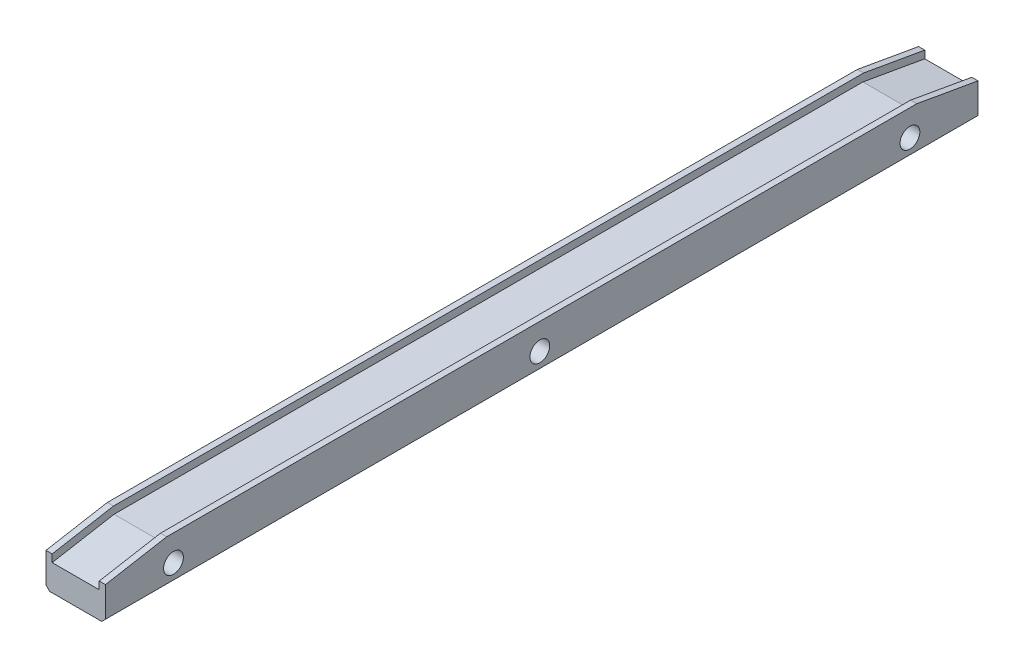
from build123d import *

# Parameters (mm, degrees)
RESSALTO_EXTRUS_O1_DEPTH = 327.5
ESBO_O2_R                = 8
CORTE_EXTRUS_O1_DEPTH    = 655
RESSALTO_EXTRUS_O2_DEPTH = 25
RESSALTO_EXTRUS_O3_DEPTH = 25
CHANFRO1_SIZE            = 50
CHANFRO1_SIZE2           = 8.816349035
CORTE_EXTRUS_O2_START    = -48
CORTE_EXTRUS_O2_DEPTH    = 48
CHANFRO2_SIZE            = 3


with BuildPart() as part:
    # Esboço1 → Ressalto-extrusão1 (new, symmetric)
    with BuildSketch(Plane.XY):
        Polygon((-19, 0), (19, 0), (19, 6), (24, 6), (24, -30), (-24, -30), (-24, 6), (-19, 6), align=None)
    extrude(amount=RESSALTO_EXTRUS_O1_DEPTH, both=True)

    # Esboço2 → Corte-extrusão1 (cut)
    with BuildSketch(Plane(origin=(24, 0, 0), x_dir=(0, 0, -1), z_dir=(1, 0, 0))):
        with Locations(Location((-297.5, -15, 0), (0, 0, 90))):
            Circle(ESBO_O2_R)
        with Locations(Location((297.5, -15, 0), (0, 0, 90))):
            Circle(ESBO_O2_R)
        with Locations(Location((-1.5, -15, 0), (0, 0, 90))):
            Circle(ESBO_O2_R)
    extrude(amount=-CORTE_EXTRUS_O1_DEPTH, mode=Mode.SUBTRACT)

    # Esboço3 → Ressalto-extrusão2 (add)
    with BuildSketch(Plane.XY.offset(327.5)):
        Polygon((-24, 6), (-24, -30), (24, -30), (24, 6), (19, 6), (19, 0), (-19, 0), (-19, 6), align=None)
    extrude(amount=RESSALTO_EXTRUS_O2_DEPTH)

    # Esboço4 → Ressalto-extrusão3 (add)
    with BuildSketch(Plane(origin=(0, 0, -327.5), x_dir=(-1, 0, 0), z_dir=(0, 0, -1))):
        Polygon((24, -30), (24, 6), (19, 6), (19, 0), (-19, 0), (-19, 6), (-24, 6), (-24, -30), align=None)
    extrude(amount=RESSALTO_EXTRUS_O3_DEPTH)

    # Chanfro1
    chanfro1_edges = [part.edges().sort_by_distance(p)[0] for p in [
        (0, 0, 352.5),
        (0, 0, -352.5),
    ]]
    chanfro1_side = [part.faces().sort_by_distance(p)[0] for p in [
        (0, 0, 0),
    ]]
    chamfer(chanfro1_edges, length=CHANFRO1_SIZE, length2=CHANFRO1_SIZE2, reference=chanfro1_side[0])

    # Esboço5 → Corte-extrusão2 (cut)
    with BuildSketch(Plane(origin=(24, 0, 0), x_dir=(0, 0, -1), z_dir=(1, 0, 0)).offset(CORTE_EXTRUS_O2_START)):
        Polygon((-352.5, -2.723789364), (-303.024931981, 6), (-352.5, 6), align=None)
        Polygon((352.5, 6), (352.5, -2.723789364), (303.024931981, 6), align=None)
    extrude(amount=CORTE_EXTRUS_O2_DEPTH, mode=Mode.SUBTRACT)

    # Chanfro2
    chanfro2_edges = [part.edges().sort_by_distance(p)[0] for p in [
        (24, -30, 0),
        (-24, -30, 0),
    ]]
    chamfer(chanfro2_edges, length=CHANFRO2_SIZE)


solid = part.part
